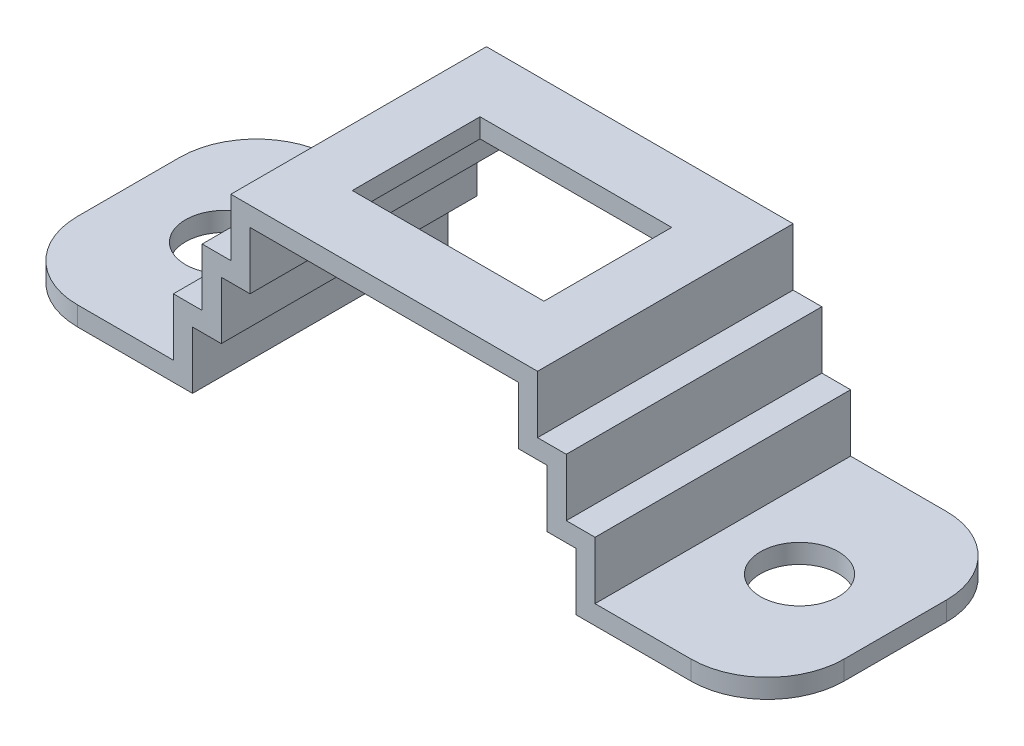
from build123d import *

# Parameters (mm, degrees)
EXTRUDE_THIN1_DEPTH = 20
SKETCH2_W           = 30
SKETCH2_H           = 20
CUT_EXTRUDE1_DEPTH  = 71
SKETCH3_R           = 6.1
CUT_EXTRUDE2_DEPTH  = 69.767724988
FILLET1_R           = 12


with BuildPart() as part:
    # Sketch1 → Extrude-Thin1 (new, symmetric)
    with BuildSketch(Plane.XY):
        Polygon((-60, 0), (-30, 0), (-30, 9), (-25.5, 9), (-25.5, 18), (-21, 18), (-21, 27), (0, 27), (0, 30), (-24, 30), (-24, 21), (-28.5, 21), (-28.5, 12), (-33, 12), (-33, 3), (-60, 3), align=None)
    extrude_thin1 = extrude(amount=EXTRUDE_THIN1_DEPTH, both=True)

    # Mirror1: Extrude-Thin1 across plane
    add(extrude_thin1.mirror(Plane(origin=(0, 30, -20), x_dir=(0, 0, 1), z_dir=(-1, 0, 0))))

    # Sketch2 → Cut-Extrude1 (cut, through all)
    with BuildSketch(Plane(origin=(0, 30, 0), x_dir=(1, 0, 0), z_dir=(0, 1, 0))):
        Rectangle(SKETCH2_W, SKETCH2_H)
    extrude(amount=-CUT_EXTRUDE1_DEPTH, mode=Mode.SUBTRACT)

    # Sketch3 → Cut-Extrude2 (cut, through all)
    with BuildSketch(Plane(origin=(0, 3, 0), x_dir=(1, 0, 0), z_dir=(0, 1, 0))):
        with Locations(Location((-45, 0, 0), (0, 0, 270))):
            Circle(SKETCH3_R)
    cut_extrude2 = extrude(amount=-CUT_EXTRUDE2_DEPTH, mode=Mode.SUBTRACT)

    # Mirror2: Cut-Extrude2 across plane
    add(cut_extrude2.mirror(Plane(origin=(0, 0, 0), x_dir=(0, 0, 1), z_dir=(1, 0, 0))), mode=Mode.SUBTRACT)

    # Fillet1
    fillet1_edges = [part.edges().sort_by_distance(p)[0] for p in [
        (-60, 1.5, 20),
        (-60, 1.5, -20),
        (60, 1.5, -20),
        (60, 1.5, 20),
    ]]
    fillet(fillet1_edges, radius=FILLET1_R)


solid = part.part
